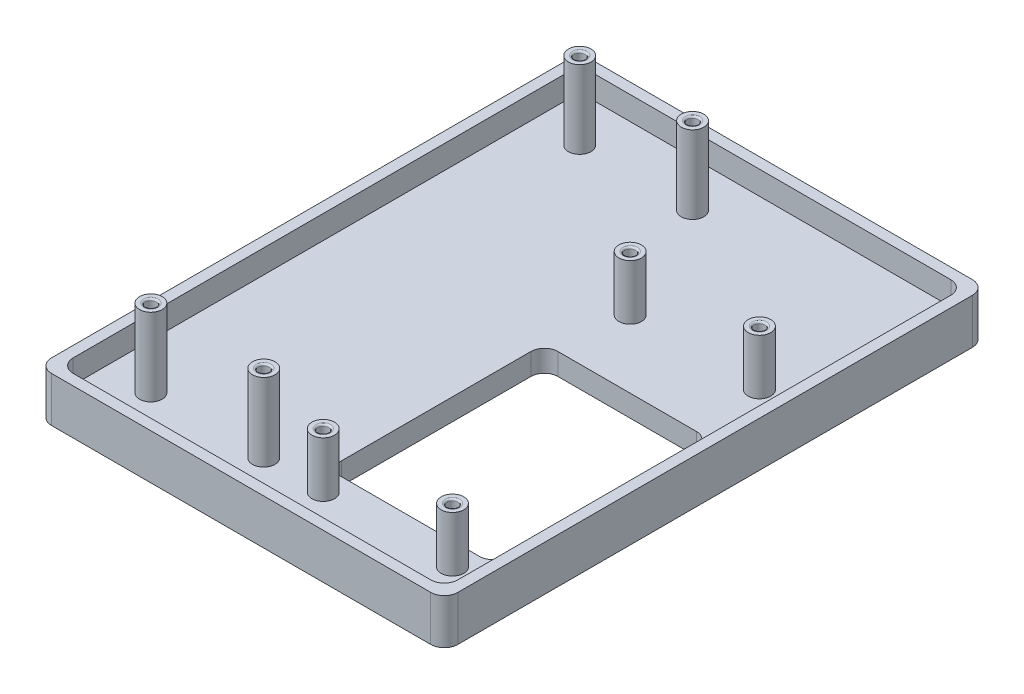
from build123d import *

# Parameters (mm, degrees)
CROQUIS1_W              = 90
CROQUIS1_H              = 120
SALIENTE_EXTRUIR1_DEPTH = 10
CROQUIS2_W              = 85.2
CROQUIS2_H              = 115.2
CORTAR_EXTRUIR1_DEPTH   = 5.2
REDONDEO1_R             = 3
CROQUIS3_R              = 2.5
SALIENTE_EXTRUIR2_DEPTH = 17.2
CROQUIS4_R              = 1.2
CORTAR_EXTRUIR2_DEPTH   = 5
REDONDEO2_R             = 0.4
CROQUIS5_R              = 2.5
SALIENTE_EXTRUIR3_DEPTH = 12.2
CROQUIS6_R              = 1.2
CORTAR_EXTRUIR3_DEPTH   = 5
REDONDEO3_R             = 0.4
CROQUIS7_W              = 36.64
CROQUIS7_H              = 48
CORTAR_EXTRUIR4_DEPTH   = 4.8
REDONDEO4_R             = 3


with BuildPart() as part:
    # Croquis1 → Saliente-Extruir1 (new body)
    with BuildSketch(Plane(origin=(0, 0, 0), x_dir=(1, 0, 0), z_dir=(0, 1, 0))):
        Rectangle(CROQUIS1_W, CROQUIS1_H)
    extrude(amount=SALIENTE_EXTRUIR1_DEPTH)

    # Croquis2 → Cortar-Extruir1 (cut)
    with BuildSketch(Plane(origin=(0, 10, 0), x_dir=(1, 0, 0), z_dir=(0, 1, 0))):
        Rectangle(CROQUIS2_W, CROQUIS2_H)
    extrude(amount=-CORTAR_EXTRUIR1_DEPTH, mode=Mode.SUBTRACT)

    # Redondeo1
    redondeo1_edges = [part.edges().sort_by_distance(p)[0] for p in [
        (-42.6, 7.4, 57.6),
        (-42.6, 7.4, -57.6),
        (42.6, 7.4, -57.6),
        (42.6, 7.4, 57.6),
        (-45, 5, -60),
        (45, 5, -60),
        (45, 5, 60),
        (-45, 5, 60),
    ]]
    fillet(redondeo1_edges, radius=REDONDEO1_R)

    # Croquis3 → Saliente-Extruir2 (add)
    with BuildSketch(Plane(origin=(0, 4.8, 0), x_dir=(1, 0, 0), z_dir=(0, 1, 0))):
        with Locations(Location((-32.5, 47.5, 0), (0, 0, 90))):
            Circle(CROQUIS3_R)
        with Locations(Location((-7.5, 47.5, 0), (0, 0, 90))):
            Circle(CROQUIS3_R)
        with Locations(Location((-7.5, -47.5, 0), (0, 0, 90))):
            Circle(CROQUIS3_R)
        with Locations(Location((-32.5, -47.5, 0), (0, 0, 90))):
            Circle(CROQUIS3_R)
    extrude(amount=SALIENTE_EXTRUIR2_DEPTH)

    # Croquis4 → Cortar-Extruir2 (cut)
    with BuildSketch(Plane(origin=(0, 22, 0), x_dir=(1, 0, 0), z_dir=(0, 1, 0))):
        with Locations(Location((-32.5, 47.5, 0), (0, 0, 270))):
            Circle(CROQUIS4_R)
        with Locations(Location((-7.5, 47.5, 0), (0, 0, 270))):
            Circle(CROQUIS4_R)
        with Locations(Location((-7.5, -47.5, 0), (0, 0, 270))):
            Circle(CROQUIS4_R)
        with Locations(Location((-32.5, -47.5, 0), (0, 0, 270))):
            Circle(CROQUIS4_R)
    extrude(amount=-CORTAR_EXTRUIR2_DEPTH, mode=Mode.SUBTRACT)

    # Redondeo2
    redondeo2_edges = [part.edges().sort_by_distance(p)[0] for p in [
        (-32.5, 22, 46.3),
        (-7.5, 22, 46.3),
        (-7.5, 22, -48.7),
        (-32.5, 22, -48.7),
    ]]
    fillet(redondeo2_edges, radius=REDONDEO2_R)

    # Croquis5 → Saliente-Extruir3 (add)
    with BuildSketch(Plane(origin=(0, 4.8, 0), x_dir=(1, 0, 0), z_dir=(0, 1, 0))):
        with Locations(Location((5.68, -47.5, 0), (0, 0, 270))):
            Circle(CROQUIS5_R)
        with Locations(Location((34.32, -47.5, 0), (0, 0, 270))):
            Circle(CROQUIS5_R)
        with Locations(Location((34.32, 20.5, 0), (0, 0, 270))):
            Circle(CROQUIS5_R)
        with Locations(Location((5.68, 20.5, 0), (0, 0, 270))):
            Circle(CROQUIS5_R)
    extrude(amount=SALIENTE_EXTRUIR3_DEPTH)

    # Croquis6 → Cortar-Extruir3 (cut)
    with BuildSketch(Plane(origin=(0, 17, 0), x_dir=(1, 0, 0), z_dir=(0, 1, 0))):
        with Locations(Location((5.68, -47.5, 0), (0, 0, 270))):
            Circle(CROQUIS6_R)
        with Locations(Location((34.32, -47.5, 0), (0, 0, 270))):
            Circle(CROQUIS6_R)
        with Locations(Location((34.32, 20.5, 0), (0, 0, 270))):
            Circle(CROQUIS6_R)
        with Locations(Location((5.68, 20.5, 0), (0, 0, 270))):
            Circle(CROQUIS6_R)
    extrude(amount=-CORTAR_EXTRUIR3_DEPTH, mode=Mode.SUBTRACT)

    # Redondeo3
    redondeo3_edges = [part.edges().sort_by_distance(p)[0] for p in [
        (5.68, 17, -21.7),
        (34.32, 17, -21.7),
        (34.32, 17, 46.3),
        (5.68, 17, 46.3),
    ]]
    fillet(redondeo3_edges, radius=REDONDEO3_R)

    # Croquis7 → Cortar-Extruir4 (cut)
    with BuildSketch(Plane(origin=(0, 4.8, 0), x_dir=(1, 0, 0), z_dir=(0, 1, 0))):
        with Locations((20, -18.5)):
            Rectangle(CROQUIS7_W, CROQUIS7_H)
    extrude(amount=-CORTAR_EXTRUIR4_DEPTH, mode=Mode.SUBTRACT)

    # Redondeo4
    redondeo4_edges = [part.edges().sort_by_distance(p)[0] for p in [
        (1.68, 2.4, 42.5),
        (1.68, 2.4, -5.5),
        (38.32, 2.4, -5.5),
        (38.32, 2.4, 42.5),
    ]]
    fillet(redondeo4_edges, radius=REDONDEO4_R)


solid = part.part
